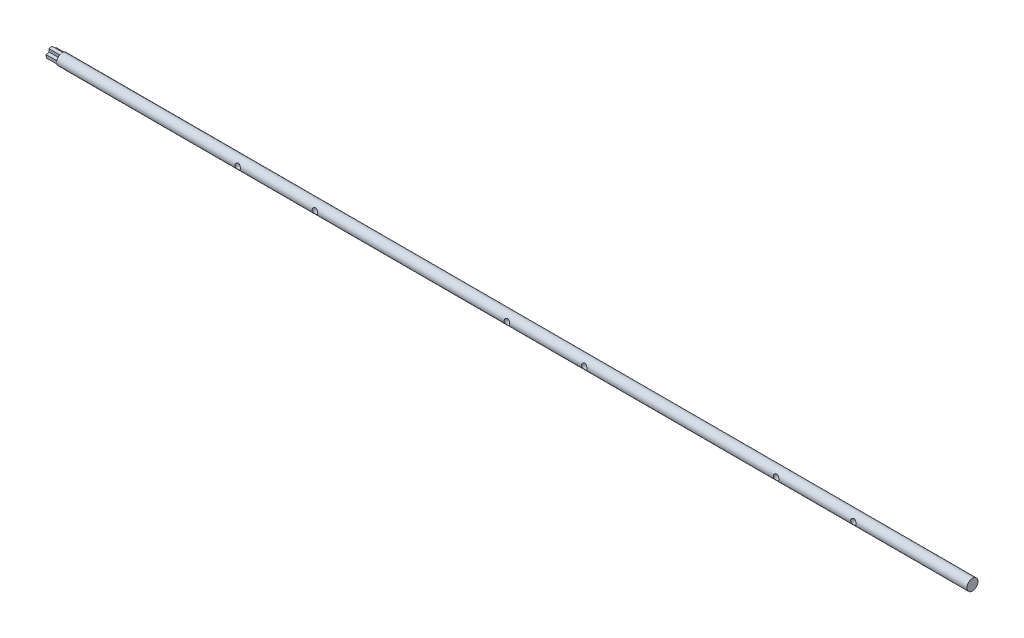
from build123d import *

# Parameters (mm, degrees)
SKETCH1_W           = 825
SKETCH1_H           = 5
BOSS_EXTRUDE1_DEPTH = 10
SKETCH3_R           = 2.5
CUT_EXTRUDE1_DEPTH  = 826.030302474
LPATTERN1_COUNT     = 3
LPATTERN1_PITCH     = 244


with BuildPart() as part:
    # Sketch1 → Revolve1 (revolve)
    with BuildSketch(Plane.XY, mode=Mode.PRIVATE) as revolve1_sk:
        with Locations((412.5, 2.5)):
            Rectangle(SKETCH1_W, SKETCH1_H)
    revolve(revolve1_sk.sketch.rotate(Axis((0, 0, 0), (-1, 0, 0)), 90), axis=Axis((0, 0, 0), (-1, 0, 0)))

    # Sketch2 → Boss-Extrude1 (add)
    with BuildSketch(Plane.ZY):
        Polygon((-4.265712588, 2.074535157), (-1.291378004, 1.68295658), (-0.899799427, 4.657291165), (2.074535157, 4.265712588), (1.68295658, 1.291378004), (4.657291165, 0.899799427), (4.265712588, -2.074535157), (1.291378004, -1.68295658), (0.899799427, -4.657291165), (-2.074535157, -4.265712588), (-1.68295658, -1.291378004), (-4.657291165, -0.899799427), align=None)
    extrude(amount=BOSS_EXTRUDE1_DEPTH)

    # Sketch3 → Cut-Extrude1 (cut, symmetric)
    with BuildSketch(Plane.XY):
        with Locations((164, 0)):
            Circle(SKETCH3_R)
        with Locations((234, 0)):
            Circle(SKETCH3_R)
    cut_extrude1 = extrude(amount=CUT_EXTRUDE1_DEPTH, both=True, mode=Mode.SUBTRACT)

    # LPattern1: Cut-Extrude1 ×3
    with Locations(*[(i * LPATTERN1_PITCH, 0, 0) for i in range(1, LPATTERN1_COUNT)]):
        add(cut_extrude1, mode=Mode.SUBTRACT)


solid = part.part
